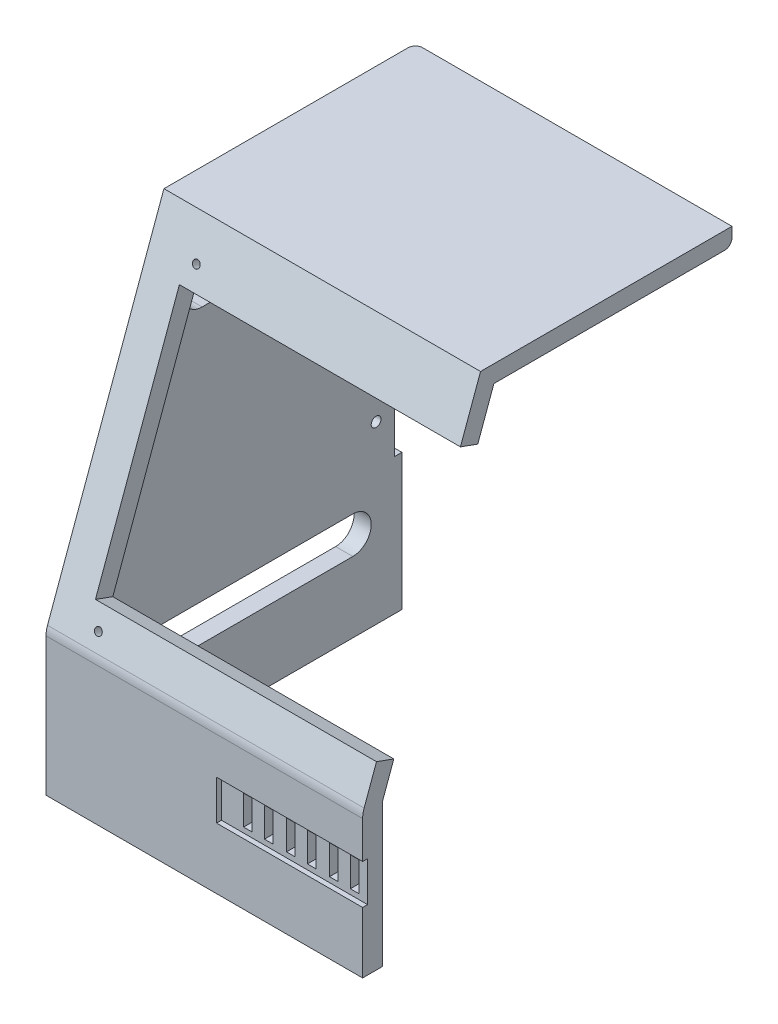
from build123d import *

# Parameters (mm, degrees)
SKETCH1_W                = 170
SKETCH1_H                = 130
BOSS_EXTRUDE1_DEPTH      = 8
SKETCH2_R                = 1.5
SKETCH2_W                = 165
SKETCH2_H                = 100
CUT_EXTRUDE1_DEPTH       = 21
SKETCH3_W                = 170
SKETCH3_H                = 20
BOSS_EXTRUDE2_DEPTH      = 8
SKETCH4_W                = 65
SKETCH4_H                = 16.2
CUT_EXTRUDE2_DEPTH       = 2
SKETCH5_W                = 3.5
SKETCH5_H                = 12
CUT_EXTRUDE3_DEPTH       = 35
SKETCH6_W                = 170
SKETCH6_H                = 150
BOSS_EXTRUDE3_DEPTH      = 8
BOSS_EXTRUDE4_DEPTH      = 138
SKETCH8_W                = 249
SKETCH8_H                = 138
BOSS_EXTRUDE5_DEPTH      = 1
SKETCH9_W                = 72.8
SKETCH9_H                = 73.25
CUT_EXTRUDE4_DEPTH       = 19
BOSS_EXTRUDE6_DEPTH      = 5
SKETCH11_R               = 1.5
CUT_EXTRUDE5_DEPTH       = 56
SKETCH12_R               = 9
SKETCH12_R_2             = 6.5
SKETCH12_R_3             = 1
SKETCH12_R_4             = 2.75
CUT_EXTRUDE6_DEPTH       = 115
SKETCH13_W               = 58.59049163
SKETCH13_H               = 30.075830986
CUT_EXTRUDE7_DEPTH       = 3
FILLET1_R                = 2
SKETCH15_R               = 1.5
CUT_EXTRUDE8_DEPTH       = 10
CUT_EXTRUDE10_DEPTH      = 261
SKETCH19_R               = 1.5
BOSS_EXTRUDE7_DEPTH      = 8
BOSS_EXTRUDE12_START     = -124.5
BOSS_EXTRUDE12_DEPTH     = 249
SKETCH22_R               = 1.5
SKETCH22_W               = 165
SKETCH22_H               = 100
CUT_EXTRUDE11_DEPTH      = 18
FILLET2_R                = 10
SKETCH24_R               = 2
SKETCH24_W               = 3
SKETCH24_H               = 72
CUT_EXTRUDE15_DEPTH      = 42
CUT_EXTRUDE16_DEPTH      = 140
CUT_EXTRUDE16_DEPTH_BACK = 242
SKETCH27_W               = 249
SKETCH27_H               = 105
BOSS_EXTRUDE13_DEPTH     = 7
CUT_EXTRUDE17_DEPTH      = 249
FILLET6_R                = 3
FILLET7_R                = 3
BOSS_EXTRUDE14_DEPTH     = 9
SKETCH30_R               = 1.5
CUT_EXTRUDE18_DEPTH      = 10
SKETCH31_R               = 1.5
CUT_EXTRUDE19_DEPTH      = 49
CUT_EXTRUDE20_DEPTH      = 49
SKETCH33_W               = 129
SKETCH33_H               = 190
CUT_EXTRUDE21_DEPTH      = 200


with BuildPart() as part:
    # Sketch1 → Boss-Extrude1 (new body)
    with BuildSketch(Plane.XY):
        with Locations((85, 65)):
            Rectangle(SKETCH1_W, SKETCH1_H)
    extrude(amount=BOSS_EXTRUDE1_DEPTH)

    # Sketch2 → Cut-Extrude1 (cut)
    with BuildSketch(Plane.XY.offset(8)):
        with Locations((6.55, 123.35)):
            Circle(SKETCH2_R)
        with Locations((163.45, 123.35)):
            Circle(SKETCH2_R)
        with Locations((6.55, 6.65)):
            Circle(SKETCH2_R)
        with Locations((163.45, 6.65)):
            Circle(SKETCH2_R)
        with Locations((85, 65)):
            Rectangle(SKETCH2_W, SKETCH2_H)
    extrude(amount=-CUT_EXTRUDE1_DEPTH, mode=Mode.SUBTRACT)

    # Sketch3 → Boss-Extrude2 (add)
    with BuildSketch(Plane.XY.offset(8)):
        with Locations((85, -10)):
            Rectangle(SKETCH3_W, SKETCH3_H)
    extrude(amount=-BOSS_EXTRUDE2_DEPTH)

    # Sketch4 → Cut-Extrude2 (cut)
    with BuildSketch(Plane.XY.offset(8)):
        with Locations((85, -10)):
            Rectangle(SKETCH4_W, SKETCH4_H)
    extrude(amount=-CUT_EXTRUDE2_DEPTH, mode=Mode.SUBTRACT)

    # Sketch5 → Cut-Extrude3 (cut)
    with BuildSketch(Plane.XY.offset(6)):
        with Locations((63.25, -10)):
            Rectangle(SKETCH5_W, SKETCH5_H)
        with Locations((71.75, -10)):
            Rectangle(SKETCH5_W, SKETCH5_H)
        with Locations((80.75, -10)):
            Rectangle(SKETCH5_W, SKETCH5_H)
        with Locations((89.25, -10)):
            Rectangle(SKETCH5_W, SKETCH5_H)
        with Locations((98.25, -10)):
            Rectangle(SKETCH5_W, SKETCH5_H)
        with Locations((106.75, -10)):
            Rectangle(SKETCH5_W, SKETCH5_H)
    extrude(amount=-CUT_EXTRUDE3_DEPTH, mode=Mode.SUBTRACT)

    # Sketch6 → Boss-Extrude3 (add)
    with BuildSketch(Plane.XY.offset(8)):
        Polygon((15.504384948, 140), (225, 140), (225, -35), (-10, -35), (-10, 140), align=None)
        with Locations((85, 55)):
            Rectangle(SKETCH6_W, SKETCH6_H, mode=Mode.SUBTRACT)
    extrude(amount=-BOSS_EXTRUDE3_DEPTH)

    # Sketch7 → Boss-Extrude4 (add)
    with BuildSketch(Plane.XY.offset(8)):
        Polygon((-10, 140), (-17, 140), (-17, -42), (232, -42), (232, 140), (225, 140), (225, -35), (-10, -35), align=None)
    extrude(amount=-BOSS_EXTRUDE4_DEPTH)

    # Sketch8 → Boss-Extrude5 (add)
    with BuildSketch(Plane.XZ.offset(42)):
        with Locations((107.5, -61)):
            Rectangle(SKETCH8_W, SKETCH8_H)
    extrude(amount=BOSS_EXTRUDE5_DEPTH)

    # Sketch9 → Cut-Extrude4 (cut)
    with BuildSketch(Plane(origin=(232, 0, 0), x_dir=(0, 0, -1), z_dir=(1, 0, 0))):
        with Locations((75, 35)):
            Rectangle(SKETCH9_W, SKETCH9_H)
    extrude(amount=-CUT_EXTRUDE4_DEPTH, mode=Mode.SUBTRACT)

    # Sketch10 → Boss-Extrude6 (add)
    with BuildSketch(Plane(origin=(232, 0, 0), x_dir=(0, 0, -1), z_dir=(1, 0, 0))):
        Polygon((36, 44), (36, -4), (114, -4), (114, 44), (119, 44), (119, -9), (31, -9), (31, 44), align=None)
    extrude(amount=BOSS_EXTRUDE6_DEPTH)

    # Sketch11 → Cut-Extrude5 (cut)
    with BuildSketch(Plane(origin=(237, 0, 0), x_dir=(0, 0, -1), z_dir=(1, 0, 0))):
        with Locations((33.5, 17.5)):
            Circle(SKETCH11_R)
        with Locations((116.5, 17.5)):
            Circle(SKETCH11_R)
    extrude(amount=-CUT_EXTRUDE5_DEPTH, mode=Mode.SUBTRACT)

    # Sketch12 → Cut-Extrude6 (cut)
    with BuildSketch(Plane(origin=(0, -35, 0), x_dir=(1, 0, 0), z_dir=(0, 1, 0))):
        with Locations(Location((166.25, 32.5, 0), (0, 0, 180))):
            Circle(SKETCH12_R)
        with Locations(Location((166.25, 97.5, 0), (0, 0, 180))):
            Circle(SKETCH12_R_2)
        with Locations(Location((155.75, 97.5, 0), (0, 0, 180))):
            Circle(SKETCH12_R_3)
        with Locations(Location((155.75, 85, 0), (0, 0, 180))):
            Circle(SKETCH12_R_3)
        with Locations(Location((176.75, 85, 0), (0, 0, 180))):
            Circle(SKETCH12_R_3)
        with Locations(Location((176.75, 97.5, 0), (0, 0, 180))):
            Circle(SKETCH12_R_3)
        with Locations(Location((145.25, 97.5, 0), (0, 0, 180))):
            Circle(SKETCH12_R_4)
        with Locations(Location((187.25, 97.5, 0), (0, 0, 180))):
            Circle(SKETCH12_R_4)
    extrude(amount=-CUT_EXTRUDE6_DEPTH, mode=Mode.SUBTRACT)

    # Sketch13 → Cut-Extrude7 (cut)
    with BuildSketch(Plane.XZ.offset(43)):
        with Locations((166.25, -93.48757215)):
            Rectangle(SKETCH13_W, SKETCH13_H)
    extrude(amount=-CUT_EXTRUDE7_DEPTH, mode=Mode.SUBTRACT)

    # Fillet1
    fillet1_edges = [part.edges().sort_by_distance(p)[0] for p in [
        (136.954754185, -40, -93.48757215),
        (166.25, -40, -78.449656657),
        (195.545245815, -40, -93.48757215),
        (166.25, -40, -108.525487643),
    ]]
    fillet(fillet1_edges, radius=FILLET1_R)

    # Sketch15 → Cut-Extrude8 (cut)
    with BuildSketch(Plane(origin=(0, 140, 0), x_dir=(1, 0, 0), z_dir=(0, 1, 0))):
        with Locations(Location((5, -4, 0), (0, 0, 270))):
            Circle(SKETCH15_R)
        with Locations(Location((20, -4, 0), (0, 0, 270))):
            Circle(SKETCH15_R)
        with Locations(Location((217, -4, 0), (0, 0, 90))):
            Circle(SKETCH15_R)
        with Locations(Location((202, -4, 0), (0, 0, 90))):
            Circle(SKETCH15_R)
    extrude(amount=-CUT_EXTRUDE8_DEPTH, mode=Mode.SUBTRACT)

    # Sketch18 → Cut-Extrude10 (cut)
    with BuildSketch(Plane(origin=(232, 0, 0), x_dir=(0, 0, -1), z_dir=(1, 0, 0))):
        Polygon((45.496279283, 140), (-8, 140), (-8, 15), (0, 15), align=None)
    extrude(amount=-CUT_EXTRUDE10_DEPTH, mode=Mode.SUBTRACT)

    # Sketch19 → Boss-Extrude7 (add)
    with BuildSketch(Plane.XY.offset(8)):
        with Locations((6.55, 6.65)):
            Circle(SKETCH19_R)
        with Locations((163.45, 6.65)):
            Circle(SKETCH19_R)
    extrude(amount=-BOSS_EXTRUDE7_DEPTH)

    # Sketch21 → Boss-Extrude12 (add)
    with BuildSketch(Plane(origin=(107.5, 0, 0), x_dir=(0, 0, -1), z_dir=(1, 0, 0)).offset(BOSS_EXTRUDE12_START)):
        Polygon((45.496279283, 140), (0, 15), (-8, 15), (37.496279283, 140), align=None)
    extrude(amount=BOSS_EXTRUDE12_DEPTH)

    # Sketch22 → Cut-Extrude11 (cut)
    with BuildSketch(Plane(origin=(0, 4.325817115, 11.885084845), x_dir=(1, 0, 0), z_dir=(0, 0.3420201433256603, 0.9396926207859115))):
        with Locations(Location((1.55, 136.220338945, 0), (0, 0, 270))):
            Circle(SKETCH22_R)
        with Locations(Location((158.45, 136.220338945, 0), (0, 0, 270))):
            Circle(SKETCH22_R)
        with Locations(Location((1.55, 19.520338945, 0), (0, 0, 270))):
            Circle(SKETCH22_R)
        with Locations(Location((158.45, 19.520338945, 0), (0, 0, 270))):
            Circle(SKETCH22_R)
        with Locations((80, 77.870338945)):
            Rectangle(SKETCH22_W, SKETCH22_H)
    extrude(amount=-CUT_EXTRUDE11_DEPTH, mode=Mode.SUBTRACT)

    # Fillet2
    fillet2_edges = [part.edges().sort_by_distance(p)[0] for p in [
        (107.5, 15, 8),
    ]]
    fillet(fillet2_edges, radius=FILLET2_R)

    # Sketch24 → Cut-Extrude15 (cut)
    with BuildSketch(Plane(origin=(-10, 0, 0), x_dir=(0, 0, -1), z_dir=(1, 0, 0))):
        with Locations(Location((113.5, 48.5, 0), (0, 0, 90))):
            Circle(SKETCH24_R)
        with Locations(Location((119.5, 68.5, 0), (0, 0, 90))):
            Circle(SKETCH24_R)
        with Locations(Location((119.5, 28.5, 0), (0, 0, 90))):
            Circle(SKETCH24_R)
        with Locations((128.5, 48.5)):
            Rectangle(SKETCH24_W, SKETCH24_H)
    extrude(amount=-CUT_EXTRUDE15_DEPTH, mode=Mode.SUBTRACT)

    # Sketch25 → Cut-Extrude16 (cut, two sides: drawn at the far end of the back side and taken through both)
    with BuildSketch(Plane(origin=(232, 0, 0), x_dir=(0, 0, -1), z_dir=(1, 0, 0)).offset(-CUT_EXTRUDE16_DEPTH_BACK)):
        Polygon((45.496279283, 140), (130, 140), (130, -43), (0, -43), (0, 15), align=None)
    extrude(amount=CUT_EXTRUDE16_DEPTH + CUT_EXTRUDE16_DEPTH_BACK, mode=Mode.SUBTRACT)

    # Sketch27 → Boss-Extrude13 (add)
    with BuildSketch(Plane(origin=(0, 140, 0), x_dir=(1, 0, 0), z_dir=(0, 1, 0))):
        with Locations((107.5, 89.996279283)):
            Rectangle(SKETCH27_W, SKETCH27_H)
    extrude(amount=BOSS_EXTRUDE13_DEPTH)

    # Sketch28 → Cut-Extrude17 (cut)
    with BuildSketch(Plane(origin=(232, 0, 0), x_dir=(0, 0, -1), z_dir=(1, 0, 0))):
        Polygon((37.496279283, 140), (40.044070923, 147), (37.496279283, 147), align=None)
    extrude(amount=-CUT_EXTRUDE17_DEPTH, mode=Mode.SUBTRACT)

    # Fillet6
    fillet6_edges = [part.edges().sort_by_distance(p)[0] for p in [
        (107.5, 140, -142.496279283),
    ]]
    fillet(fillet6_edges, radius=FILLET6_R)

    # Fillet7
    fillet7_edges = [part.edges().sort_by_distance(p)[0] for p in [
        (-17, 145, -142.496279283),
        (-17, 140, -134.748139642),
        (-17, 140.878679656, -141.617599627),
    ]]
    fillet(fillet7_edges, radius=FILLET7_R)

    # Sketch29 → Boss-Extrude14 (add)
    with BuildSketch(Plane(origin=(232, 0, 0), x_dir=(0, 0, -1), z_dir=(1, 0, 0))):
        with BuildLine():
            Line((-8, -43), (0, -43))
            Line((0, -43), (0, 15))
            Line((0, 15), (45.496279283, 140))
            Line((45.496279283, 140), (139.496279283, 140))
            ThreePointArc((139.496279283, 140), (141.886652657, 140.990125071), (142.876777727, 143.380498444))
            Line((142.876777727, 143.380498444), (142.496279283, 147))
            Line((142.496279283, 147), (40.044070923, 147))
            Line((40.044070923, 147), (-7.396926208, 16.656931626))
            ThreePointArc((-7.396926208, 16.656931626), (-7.84807753, 14.97321197), (-8, 13.236730193))
            Line((-8, 13.236730193), (-8, -43))
        make_face()
    extrude(amount=BOSS_EXTRUDE14_DEPTH)

    # Sketch30 → Cut-Extrude18 (cut)
    with BuildSketch(Plane(origin=(0, 147, 0), x_dir=(1, 0, 0), z_dir=(0, 1, 0))):
        with Locations(Location((218.25, 136.876777727, 0), (0, 0, 270))):
            Circle(SKETCH30_R)
        with Locations(Location((203.25, 136.876777727, 0), (0, 0, 270))):
            Circle(SKETCH30_R)
    extrude(amount=-CUT_EXTRUDE18_DEPTH, mode=Mode.SUBTRACT)

    # Sketch31 → Cut-Extrude19 (cut)
    with BuildSketch(Plane.XY.offset(8)):
        with Locations((219, -39)):
            Circle(SKETCH31_R)
        with Locations((204, -39)):
            Circle(SKETCH31_R)
    extrude(amount=-CUT_EXTRUDE19_DEPTH, mode=Mode.SUBTRACT)

    # Sketch32 → Cut-Extrude20 (cut)
    with BuildSketch(Plane.ZY.offset(17)):
        with BuildLine():
            Line((-110, 0.736730193), (-12, 0.736730193))
            ThreePointArc((-12, 0.736730193), (-4.5, -6.763269807), (-12, -14.263269807))
            Line((-12, -14.263269807), (-110, -14.263269807))
            ThreePointArc((-110, -14.263269807), (-117.5, -6.763269807), (-110, 0.736730193))
        make_face()
        with BuildLine():
            Line((-110, 119.5), (-48.588668173, 119.5))
            ThreePointArc((-48.588668173, 119.5), (-41.088668173, 112), (-48.588668173, 104.5))
            Line((-48.588668173, 104.5), (-110, 104.5))
            ThreePointArc((-110, 104.5), (-117.5, 112), (-110, 119.5))
        make_face()
    extrude(amount=-CUT_EXTRUDE20_DEPTH, mode=Mode.SUBTRACT)

    # Sketch33 → Cut-Extrude21 (cut)
    with BuildSketch(Plane.XY.offset(8)):
        with Locations((176.5, 52)):
            Rectangle(SKETCH33_W, SKETCH33_H)
    extrude(amount=-CUT_EXTRUDE21_DEPTH, mode=Mode.SUBTRACT)


solid = part.part
